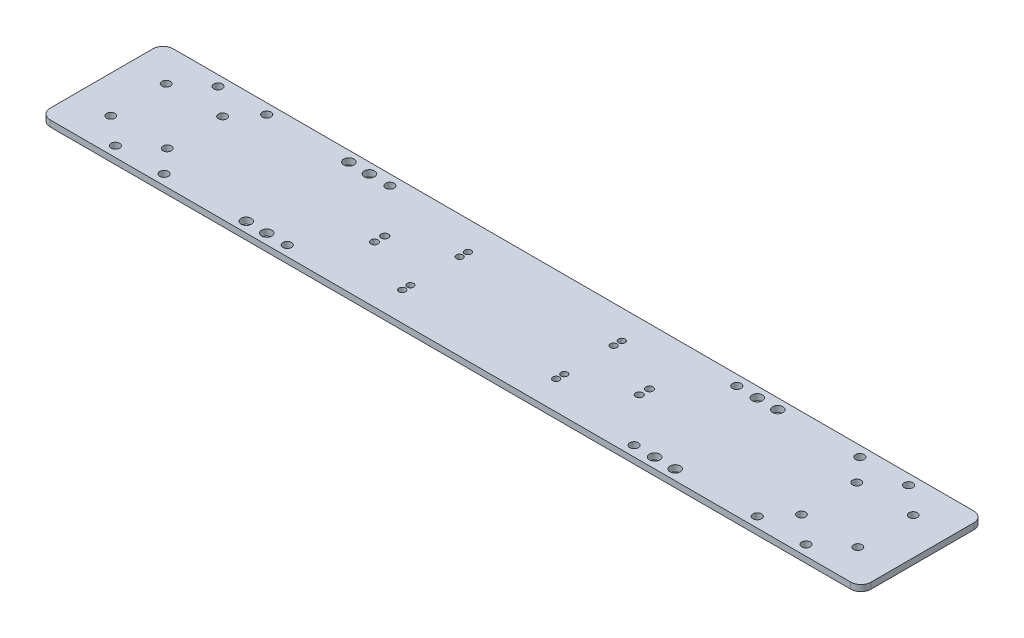
from build123d import *

# Parameters (mm, degrees)
SKETCH_1_W             = 400
SKETCH_1_H             = 60
EXTRUDE_1_DEPTH        = 3
SKETCH_2_R             = 2.05
SKETCH_2_R_2           = 2.1
CUT_EXTRUDE_1_DEPTH    = 245.031817222
SKETCH_3_R             = 1.6
CUT_EXTRUDE_1864_DEPTH = 10
SKETCH_4_R             = 1.75
SKETCH_4_R_2           = 2.5
CUT_EXTRUDE_2_DEPTH    = 245.031817222
FILLET_1_R             = 5


with BuildPart() as part:
    # 草图1 → 凸台-拉伸1 (new body)
    with BuildSketch(Plane(origin=(0, 0, 0), x_dir=(1, 0, 0), z_dir=(0, 1, 0))):
        with Locations((-21.441364286, 72.5)):
            Rectangle(SKETCH_1_W, SKETCH_1_H)
    extrude(amount=EXTRUDE_1_DEPTH)

    # 草图2 → 切除-拉伸1 (cut, through all)
    with BuildSketch(Plane(origin=(0, 3, 0), x_dir=(1, 0, 0), z_dir=(0, 1, 0))):
        with Locations(Location((-203.441364286, 86, 0), (0, 0, 270))):
            Circle(SKETCH_2_R)
        with Locations(Location((-203.441364286, 59, 0), (0, 0, 270))):
            Circle(SKETCH_2_R)
        with Locations(Location((-175.941364286, 86, 0), (0, 0, 270))):
            Circle(SKETCH_2_R)
        with Locations(Location((-175.941364286, 59, 0), (0, 0, 90))):
            Circle(SKETCH_2_R)
        with Locations(Location((-105.941364286, 97.5, 0), (0, 0, 270))):
            Circle(SKETCH_2_R_2)
        with Locations(Location((-165.941364286, 97.5, 0), (0, 0, 270))):
            Circle(SKETCH_2_R_2)
        with Locations(Location((-105.941364286, 47.5, 0), (0, 0, 90))):
            Circle(SKETCH_2_R_2)
        with Locations(Location((-165.941364286, 47.5, 0), (0, 0, 90))):
            Circle(SKETCH_2_R_2)
        with Locations(Location((-189.691364286, 97.5, 0), (0, 0, 270))):
            Circle(SKETCH_2_R_2)
        with Locations(Location((-189.691364286, 47.5, 0), (0, 0, 90))):
            Circle(SKETCH_2_R_2)
        with Locations(Location((133.058635714, 86, 0), (0, 0, 90))):
            Circle(SKETCH_2_R)
        with Locations(Location((146.808635714, 47.5, 0), (0, 0, 270))):
            Circle(SKETCH_2_R_2)
        with Locations(Location((160.558635714, 59, 0), (0, 0, 90))):
            Circle(SKETCH_2_R)
        with Locations(Location((133.058635714, 59, 0), (0, 0, 270))):
            Circle(SKETCH_2_R)
        with Locations(Location((123.058635714, 47.5, 0), (0, 0, 270))):
            Circle(SKETCH_2_R_2)
        with Locations(Location((63.058635714, 47.5, 0), (0, 0, 270))):
            Circle(SKETCH_2_R_2)
        with Locations(Location((63.058635714, 97.5, 0), (0, 0, 90))):
            Circle(SKETCH_2_R_2)
        with Locations(Location((123.058635714, 97.5, 0), (0, 0, 90))):
            Circle(SKETCH_2_R_2)
        with Locations(Location((146.808635714, 97.5, 0), (0, 0, 90))):
            Circle(SKETCH_2_R_2)
        with Locations(Location((160.558635714, 86, 0), (0, 0, 90))):
            Circle(SKETCH_2_R)
    extrude(amount=-CUT_EXTRUDE_1_DEPTH, mode=Mode.SUBTRACT)

    # 草图3 → Cut-Extrude 1864 (cut)
    with BuildSketch(Plane(origin=(0, 3, 0), x_dir=(1, 0, 0), z_dir=(0, 1, 0))):
        with Locations(Location((-58.941364286, 88.5, 0), (0, 0, 270))):
            Circle(SKETCH_3_R)
        with Locations(Location((16.058635714, 88.5, 0), (0, 0, 270))):
            Circle(SKETCH_3_R)
        with Locations(Location((16.058635714, 56.5, 0), (0, 0, 270))):
            Circle(SKETCH_3_R)
        with Locations(Location((-58.941364286, 56.5, 0), (0, 0, 270))):
            Circle(SKETCH_3_R)
        with Locations(Location((-58.941364286, 84.5, 0), (0, 0, 270))):
            Circle(SKETCH_3_R)
        with Locations(Location((-58.941364286, 60.5, 0), (0, 0, 270))):
            Circle(SKETCH_3_R)
        with Locations(Location((16.058635714, 60.5, 0), (0, 0, 270))):
            Circle(SKETCH_3_R)
        with Locations(Location((16.058635714, 84.5, 0), (0, 0, 270))):
            Circle(SKETCH_3_R)
    extrude(amount=-CUT_EXTRUDE_1864_DEPTH, mode=Mode.SUBTRACT)

    # 草图4 → 切除-拉伸2 (cut, through all)
    with BuildSketch(Plane(origin=(0, 3, 0), x_dir=(1, 0, 0), z_dir=(0, 1, 0))):
        with Locations(Location((-85.941364286, 75, 0), (0, 0, 270))):
            Circle(SKETCH_4_R)
        with Locations(Location((-85.941364286, 70, 0), (0, 0, 90))):
            Circle(SKETCH_4_R)
        with Locations(Location((43.058635714, 70, 0), (0, 0, 270))):
            Circle(SKETCH_4_R)
        with Locations(Location((43.058635714, 75, 0), (0, 0, 90))):
            Circle(SKETCH_4_R)
        with Locations(Location((-115.941364286, 47.5, 0), (0, 0, 270))):
            Circle(SKETCH_4_R_2)
        with Locations(Location((-125.941364286, 47.5, 0), (0, 0, 270))):
            Circle(SKETCH_4_R_2)
        with Locations(Location((-115.941364286, 97.5, 0), (0, 0, 90))):
            Circle(SKETCH_4_R_2)
        with Locations(Location((-125.941364286, 97.5, 0), (0, 0, 90))):
            Circle(SKETCH_4_R_2)
        with Locations(Location((73.058635714, 47.5, 0), (0, 0, 90))):
            Circle(SKETCH_4_R_2)
        with Locations(Location((83.058635714, 47.5, 0), (0, 0, 90))):
            Circle(SKETCH_4_R_2)
        with Locations(Location((73.058635714, 97.5, 0), (0, 0, 270))):
            Circle(SKETCH_4_R_2)
        with Locations(Location((83.058635714, 97.5, 0), (0, 0, 270))):
            Circle(SKETCH_4_R_2)
    extrude(amount=-CUT_EXTRUDE_2_DEPTH, mode=Mode.SUBTRACT)

    # 圆角1
    fillet_1_edges = [part.edges().sort_by_distance(p)[0] for p in [
        (-221.441364286, 1.5, -42.5),
        (-221.441364286, 1.5, -102.5),
        (178.558635714, 1.5, -102.5),
        (178.558635714, 1.5, -42.5),
    ]]
    fillet(fillet_1_edges, radius=FILLET_1_R)


solid = part.part
